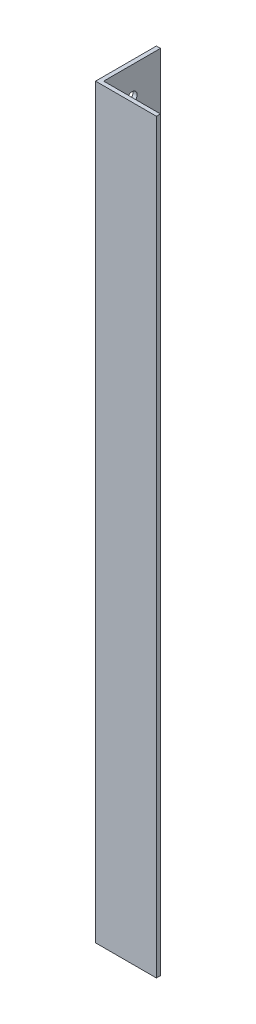
from build123d import *

# Parameters (mm, degrees)
SKETCH_1_W          = 15
SKETCH_1_H          = 1
EXTRUDE_1_DEPTH     = 184
SKETCH_3_W          = 1
SKETCH_3_H          = 184
EXTRUDE_2_DEPTH     = 14
M3X0_5_1_D          = 2.5
SKETCH_7_R          = 2
CUT_EXTRUDE_1_DEPTH = 92


with BuildPart() as part:
    # ｽｹｯﾁ1 → ﾎﾞｽ - 押し出し1 (new body)
    with BuildSketch(Plane(origin=(0, 0, 0), x_dir=(1, 0, 0), z_dir=(0, 1, 0))):
        with Locations((7.5, -0.5)):
            Rectangle(SKETCH_1_W, SKETCH_1_H)
    extrude(amount=EXTRUDE_1_DEPTH)

    # ｽｹｯﾁ3 → ﾎﾞｽ - 押し出し2 (add)
    with BuildSketch(Plane(origin=(0, 0, 0), x_dir=(-1, 0, 0), z_dir=(0, 0, -1))):
        with Locations((-0.5, 92)):
            Rectangle(SKETCH_3_W, SKETCH_3_H)
    extrude(amount=EXTRUDE_2_DEPTH)

    # M3x0.5 ねじ穴1 (through all)
    with Locations(Plane.ZY):
        with Locations((-7, 7), (-7, 177)):
            Hole(M3X0_5_1_D / 2)

    # ｽｹｯﾁ7 → ｶｯﾄ - 押し出し1 (cut)
    with BuildSketch(Plane.ZY):
        with Locations((-7, 92)):
            Circle(SKETCH_7_R)
    extrude(amount=-CUT_EXTRUDE_1_DEPTH, mode=Mode.SUBTRACT)


solid = part.part
